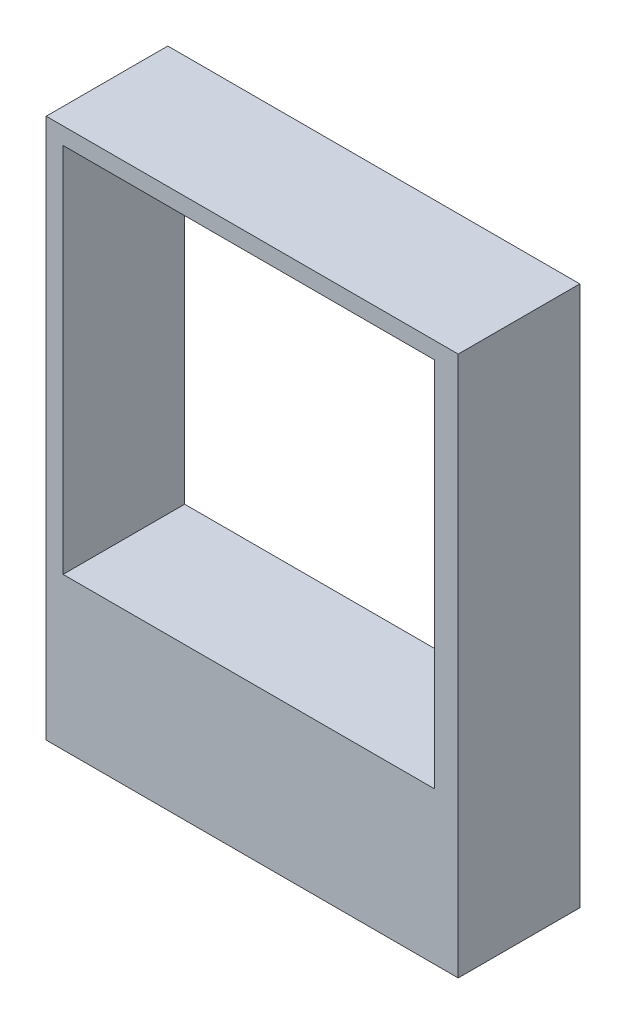
from build123d import *

# Parameters (mm, degrees)
ESQUISSE1_W        = 122
ESQUISSE1_H        = 160
ESQUISSE1_W_2      = 110
ESQUISSE1_H_2      = 110
BOSS_EXTRU_1_DEPTH = 36


with BuildPart() as part:
    # Esquisse1 → Boss.-Extru.1 (new body)
    with BuildSketch(Plane.XY):
        with Locations((64.122927327, 82.178363229)):
            Rectangle(ESQUISSE1_W, ESQUISSE1_H)
        with Locations((63.122927327, 102.178363229)):
            Rectangle(ESQUISSE1_W_2, ESQUISSE1_H_2, mode=Mode.SUBTRACT)
    extrude(amount=BOSS_EXTRU_1_DEPTH)


solid = part.part
